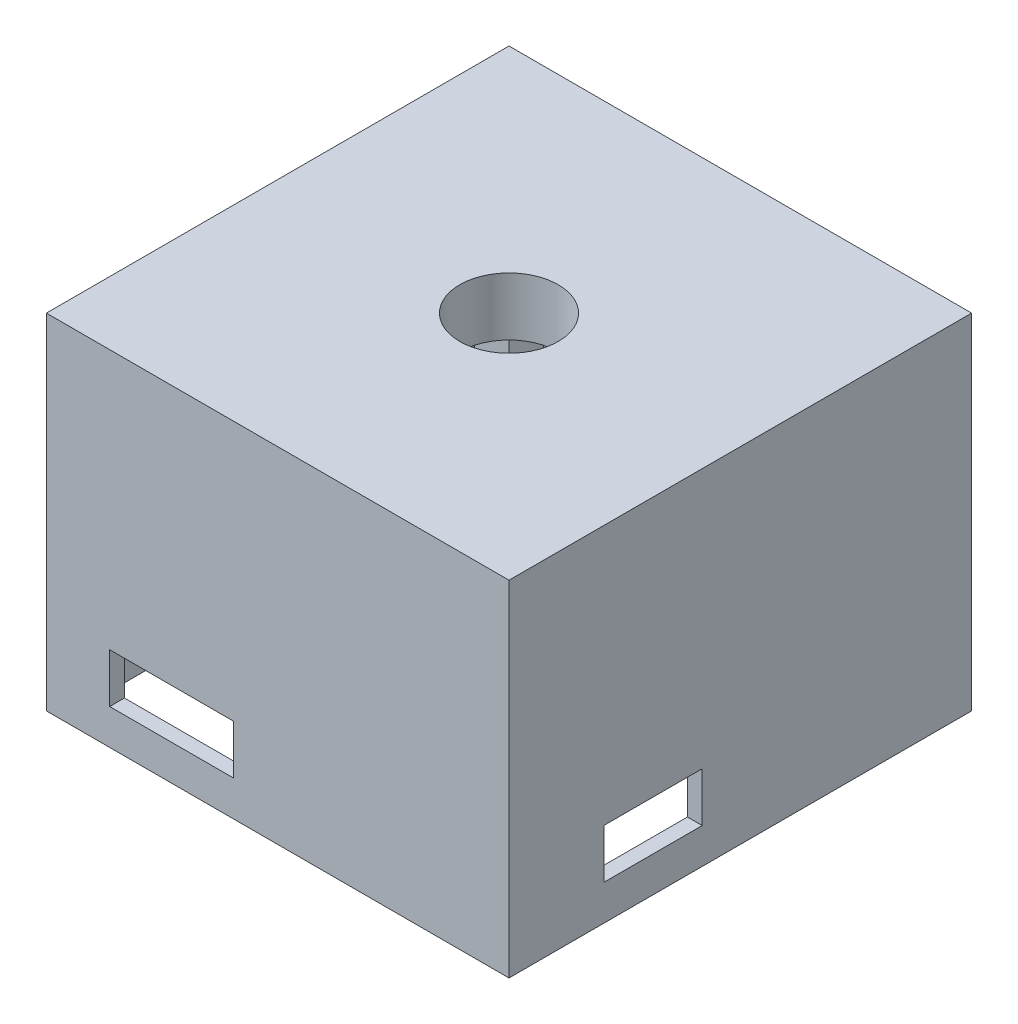
from build123d import *

# Parameters (mm, degrees)
SKETCH1_W                                  = 47
SKETCH1_H                                  = 47
BOSS_EXTRUDE1_DEPTH                        = 32
SKETCH2_W                                  = 44
SKETCH2_H                                  = 44
CUT_EXTRUDE1_DEPTH                         = 26.1
SKETCH3_W                                  = 3.5
SKETCH3_H                                  = 3.5
BOSS_EXTRUDE2_DEPTH                        = 20.5
MIRROR1_AT_THE_SECOND_PLANE_COPY_1_SKETC_W = 3.5
MIRROR1_AT_THE_SECOND_PLANE_COPY_1_SKETC_H = 3.5
MIRROR1_AT_THE_SECOND_PLANE_COPY_1_DEPTH   = 20.5
CUT_EXTRUDE3_REACH                         = 63.524
SKETCH4_W                                  = 2
SKETCH4_H                                  = 20
LPATTERN1_COUNT                            = 7
LPATTERN1_PITCH                            = 4
BOSS_EXTRUDE4_START                        = -1.5
SKETCH8_W                                  = 26
SKETCH8_H                                  = 2
BOSS_EXTRUDE4_DEPTH                        = 1.5
LPATTERN2_COUNT                            = 5
LPATTERN2_PITCH                            = 4
SKETCH6_W                                  = 47
SKETCH6_H                                  = 47
SKETCH6_W_2                                = 44
SKETCH6_H_2                                = 44
BOSS_EXTRUDE5_DEPTH                        = 3
SKETCH7_R                                  = 5
CUT_EXTRUDE4_DEPTH                         = 10
SKETCH10_W                                 = 10
SKETCH10_H                                 = 5
CUT_EXTRUDE5_DEPTH                         = 62.524385409
SKETCH12_W                                 = 12.571328749
SKETCH12_H                                 = 5
CUT_EXTRUDE6_DEPTH                         = 10


with BuildPart() as part:
    # Sketch1 → Boss-Extrude1 (new body)
    with BuildSketch(Plane(origin=(0, 0, 0), x_dir=(1, 0, 0), z_dir=(0, 1, 0))):
        Rectangle(SKETCH1_W, SKETCH1_H)
    extrude(amount=BOSS_EXTRUDE1_DEPTH)

    # Sketch2 → Cut-Extrude1 (cut)
    with BuildSketch(Plane.XZ):
        Rectangle(SKETCH2_W, SKETCH2_H)
    extrude(amount=-CUT_EXTRUDE1_DEPTH, mode=Mode.SUBTRACT)

    # Sketch3 → Boss-Extrude2 (add)
    with BuildSketch(Plane.XZ.offset(-26.1)):
        with Locations((-20.25, 20.25)):
            Rectangle(SKETCH3_W, SKETCH3_H)
    boss_extrude2 = extrude(amount=BOSS_EXTRUDE2_DEPTH)

    # Mirror1: Boss-Extrude2 across plane
    add(boss_extrude2.mirror(Plane(origin=(0, 0, 0), x_dir=(0, 0, 1), z_dir=(1, 0, 0))))

    # Mirror1 at the second plane: Boss-Extrude2 across plane
    add(boss_extrude2.mirror(Plane.XY))

    # Mirror1 at the second plane copy 1 sketc → Mirror1 at the second plane copy 1 (add)
    with BuildSketch(Plane(origin=(0, 26.1, 0), x_dir=(-1, 0, 0), z_dir=(0, -1, 0))):
        with Locations((-20.25, 20.25)):
            Rectangle(MIRROR1_AT_THE_SECOND_PLANE_COPY_1_SKETC_W, MIRROR1_AT_THE_SECOND_PLANE_COPY_1_SKETC_H)
    extrude(amount=MIRROR1_AT_THE_SECOND_PLANE_COPY_1_DEPTH)

    # Sketch4 → Cut-Extrude3 (cut, up to next)
    with BuildSketch(Plane(origin=(0, 0, -23.5), x_dir=(-1, 0, 0), z_dir=(0, 0, -1)), mode=Mode.PRIVATE) as cut_extrude3_sk1:
        with Locations((-12, 13.157296847)):
            Rectangle(SKETCH4_W, SKETCH4_H)
    cut_extrude3_tool1 = extrude(cut_extrude3_sk1.sketch, amount=-CUT_EXTRUDE3_REACH, mode=Mode.PRIVATE) & part.part
    cut_extrude3 = cut_extrude3_tool1.solids().sort_by_distance((12, 13.157297, -23.5))[0]
    add(cut_extrude3, mode=Mode.SUBTRACT)

    # LPattern1: Cut-Extrude3 ×7
    with Locations(*[(-i * LPATTERN1_PITCH, 0, 0) for i in range(1, LPATTERN1_COUNT)]):
        add(cut_extrude3, mode=Mode.SUBTRACT)

    # Sketch8 → Boss-Extrude4 (add)
    with BuildSketch(Plane(origin=(0, 0, -23.5), x_dir=(-1, 0, 0), z_dir=(0, 0, -1)).offset(BOSS_EXTRUDE4_START)):
        with Locations((0, 20.157296847)):
            Rectangle(SKETCH8_W, SKETCH8_H)
    boss_extrude4 = extrude(amount=BOSS_EXTRUDE4_DEPTH)

    # LPattern2: Boss-Extrude4 ×5
    with Locations(*[(0, -i * LPATTERN2_PITCH, 0) for i in range(1, LPATTERN2_COUNT)]):
        add(boss_extrude4)

    # Sketch6 → Boss-Extrude5 (add)
    with BuildSketch(Plane.XZ):
        Rectangle(SKETCH6_W, SKETCH6_H)
        Rectangle(SKETCH6_W_2, SKETCH6_H_2, mode=Mode.SUBTRACT)
    extrude(amount=BOSS_EXTRUDE5_DEPTH)

    # Sketch7 → Cut-Extrude4 (cut)
    with BuildSketch(Plane(origin=(0, 32, 0), x_dir=(1, 0, 0), z_dir=(0, 1, 0))):
        with Locations(Location((0, 0, 0), (0, 0, 270))):
            Circle(SKETCH7_R)
    extrude(amount=-CUT_EXTRUDE4_DEPTH, mode=Mode.SUBTRACT)

    # Sketch10 → Cut-Extrude5 (cut, through all)
    with BuildSketch(Plane.ZY.offset(23.5)):
        with Locations((8.871811033, 3.1)):
            Rectangle(SKETCH10_W, SKETCH10_H)
    extrude(amount=-CUT_EXTRUDE5_DEPTH, mode=Mode.SUBTRACT)

    # Sketch12 → Cut-Extrude6 (cut)
    with BuildSketch(Plane.XY.offset(23.5)):
        with Locations((-10.783165608, 3.1)):
            Rectangle(SKETCH12_W, SKETCH12_H)
    extrude(amount=-CUT_EXTRUDE6_DEPTH, mode=Mode.SUBTRACT)


solid = part.part
